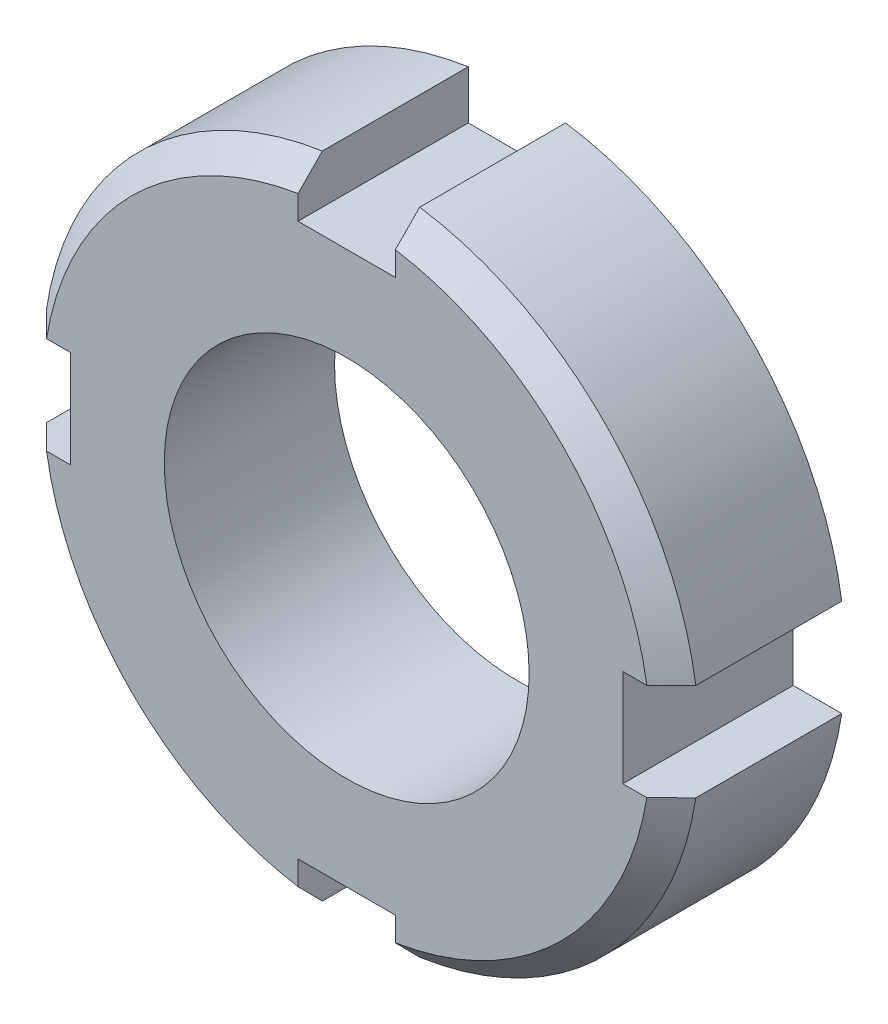
from build123d import *

# Parameters (mm, degrees)
SKETCH2_R           = 13.5
BOSS_EXTRUDE2_DEPTH = 7
CUT_EXTRUDE1_DEPTH  = 21.334699408
SKETCH5_R           = 7.5
CUT_EXTRUDE2_DEPTH  = 21.137030566
CHAMFER1_SIZE       = 1


with BuildPart() as part:
    # Sketch2 → Boss-Extrude2 (new body)
    with BuildSketch(Plane.XY):
        Circle(SKETCH2_R)
    extrude(amount=BOSS_EXTRUDE2_DEPTH)

    # Sketch4 → Cut-Extrude1 (cut, through all)
    with BuildSketch(Plane.XY.offset(7)):
        with BuildLine():
            Line((-2, 13.351029923), (-2, 11.351029923))
            Line((-2, 11.351029923), (2, 11.351029923))
            Line((2, 11.351029923), (2, 13.351029923))
            ThreePointArc((2, 13.351029923), (0, 13.5), (-2, 13.351029923))
        make_face()
        with BuildLine():
            Line((13.351029923, 2), (11.351029923, 2))
            Line((11.351029923, 2), (11.351029923, -2))
            Line((11.351029923, -2), (13.351029923, -2))
            ThreePointArc((13.351029923, -2), (13.5, 0), (13.351029923, 2))
        make_face()
        with BuildLine():
            Line((2, -13.351029923), (2, -11.351029923))
            Line((2, -11.351029923), (-2, -11.351029923))
            Line((-2, -11.351029923), (-2, -13.351029923))
            ThreePointArc((-2, -13.351029923), (0, -13.5), (2, -13.351029923))
        make_face()
        with BuildLine():
            Line((-13.351029923, -2), (-11.351029923, -2))
            Line((-11.351029923, -2), (-11.351029923, 2))
            Line((-11.351029923, 2), (-13.351029923, 2))
            ThreePointArc((-13.351029923, 2), (-13.5, 0), (-13.351029923, -2))
        make_face()
    extrude(amount=-CUT_EXTRUDE1_DEPTH, mode=Mode.SUBTRACT)

    # Sketch5 → Cut-Extrude2 (cut, through all)
    with BuildSketch(Plane.XY.offset(7)):
        Circle(SKETCH5_R)
    extrude(amount=-CUT_EXTRUDE2_DEPTH, mode=Mode.SUBTRACT)

    # Chamfer1
    chamfer1_edges = [part.edges().sort_by_distance(p)[0] for p in [
        (-9.545941546, 9.545941546, 7),
        (-9.545941546, -9.545941546, 7),
        (9.545941546, -9.545941546, 7),
        (9.545941546, 9.545941546, 7),
    ]]
    chamfer(chamfer1_edges, length=CHAMFER1_SIZE)


solid = part.part
